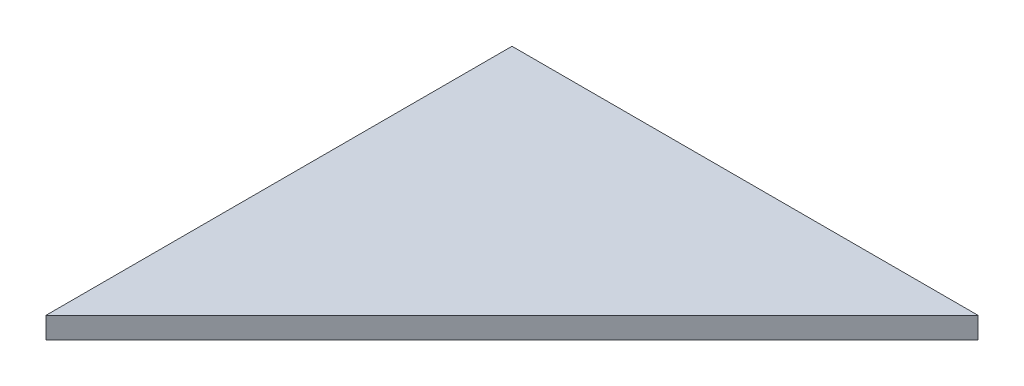
from build123d import *

# Parameters (mm, degrees)
SKETCH1_W               = 69.85
SKETCH1_H               = 69.85
BOSS_EXTRUDE1_DEPTH     = 3.175
CUT_EXTRUDE2_DEPTH      = 99.833828343
CUT_EXTRUDE2_DEPTH_BACK = 3.175


with BuildPart() as part:
    # Sketch1 → Boss-Extrude1 (new body)
    with BuildSketch(Plane(origin=(0, 0, 0), x_dir=(1, 0, 0), z_dir=(0, 1, 0))):
        with Locations((34.925, 34.925)):
            Rectangle(SKETCH1_W, SKETCH1_H)
    extrude(amount=BOSS_EXTRUDE1_DEPTH)

    # Sketch2 → Cut-Extrude2 (cut, two sides: drawn at the far end of the back side and taken through both)
    with BuildSketch(Plane(origin=(0, 3.175, 0), x_dir=(1, 0, 0), z_dir=(0, 1, 0)).offset(-CUT_EXTRUDE2_DEPTH_BACK)):
        Polygon((-146.771067812, -146.771067812), (0, 0), (69.85, 69.85), (216.621067812, 216.621067812), (510.163203436, -76.921067812), (146.771067812, -440.313203436), align=None)
    extrude(amount=CUT_EXTRUDE2_DEPTH + CUT_EXTRUDE2_DEPTH_BACK, mode=Mode.SUBTRACT)


solid = part.part
